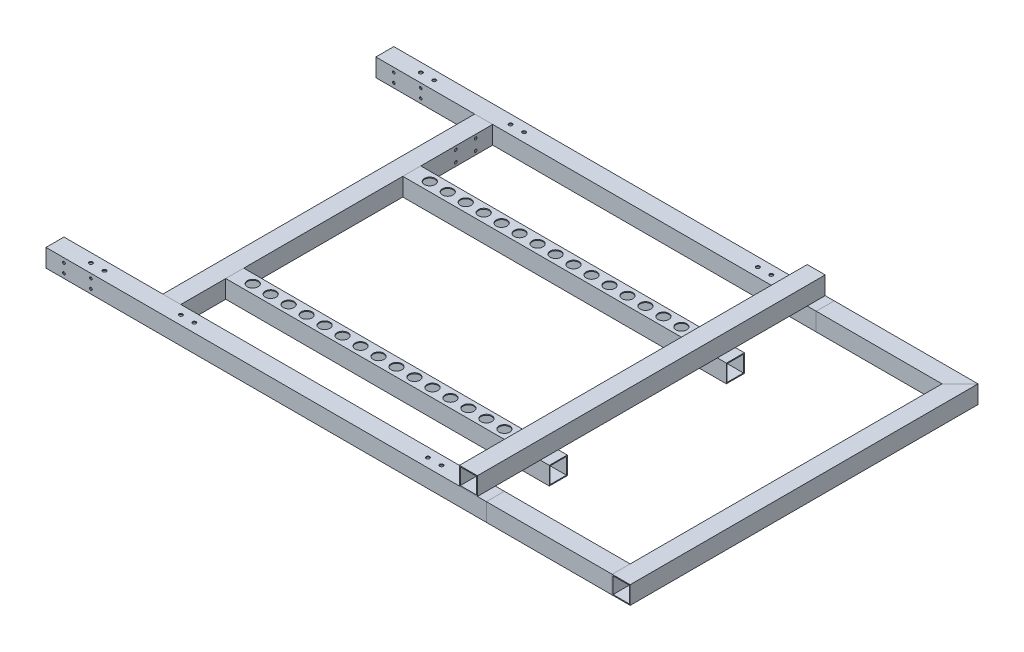
from build123d import *

# Parameters (mm, degrees)
SKETCH_11_W                 = 20
SKETCH_11_H                 = 20
SKETCH_11_W_2               = 18
SKETCH_11_H_2               = 18
F_20X20X1_1_DEPTH           = 500
SKETCH_11_ON_SEGMENT_2_W    = 20
SKETCH_11_ON_SEGMENT_2_H    = 20
SKETCH_11_ON_SEGMENT_2_W_2  = 18
SKETCH_11_ON_SEGMENT_2_H_2  = 18
F_20X20X1_1_2_DEPTH         = 515.142135624
SKETCH_11_ON_SEGMENT_3_W    = 20
SKETCH_11_ON_SEGMENT_3_H    = 20
SKETCH_11_ON_SEGMENT_3_W_2  = 18
SKETCH_11_ON_SEGMENT_3_H_2  = 18
F_20X20X1_1_3_DEPTH         = 110.284271247
SKETCH_11_ON_SEGMENT_4_W    = 20
SKETCH_11_ON_SEGMENT_4_H    = 20
SKETCH_11_ON_SEGMENT_4_W_2  = 18
SKETCH_11_ON_SEGMENT_4_H_2  = 18
F_20X20X1_1_4_DEPTH         = 515.142135624
SKETCH_11_ON_SEGMENT_5_W    = 20
SKETCH_11_ON_SEGMENT_5_H    = 20
SKETCH_11_ON_SEGMENT_5_W_2  = 18
SKETCH_11_ON_SEGMENT_5_H_2  = 18
F_20X20X1_1_5_DEPTH         = 369
SKETCH_11_ON_SEGMENT_6_W    = 20
SKETCH_11_ON_SEGMENT_6_H    = 20
SKETCH_11_ON_SEGMENT_6_W_2  = 18
SKETCH_11_ON_SEGMENT_6_H_2  = 18
F_20X20X1_1_6_DEPTH         = 82
SKETCH_12_R                 = 1.5
CUT_EXTRUDE_1_DEPTH         = 633.35195896
SKETCH_14_W                 = 20
SKETCH_14_H                 = 20
SKETCH_14_W_2               = 18
SKETCH_14_H_2               = 18
F_20X20X1_2_DEPTH           = 165.142135624
SKETCH_14_ON_SEGMENT_2_W    = 20
SKETCH_14_ON_SEGMENT_2_H    = 20
SKETCH_14_ON_SEGMENT_2_W_2  = 18
SKETCH_14_ON_SEGMENT_2_H_2  = 18
F_20X20X1_2_2_DEPTH         = 477.284271247
SKETCH_14_ON_SEGMENT_3_W    = 20
SKETCH_14_ON_SEGMENT_3_H    = 20
SKETCH_14_ON_SEGMENT_3_W_2  = 18
SKETCH_14_ON_SEGMENT_3_H_2  = 18
F_20X20X1_2_3_DEPTH         = 165.142135624
SKETCH_14_ON_SEGMENT_4_W    = 20
SKETCH_14_ON_SEGMENT_4_H    = 20
SKETCH_14_ON_SEGMENT_4_W_2  = 18
SKETCH_14_ON_SEGMENT_4_H_2  = 18
F_20X20X1_2_4_DEPTH         = 151
SKETCH_16_W                 = 20
SKETCH_16_H                 = 20
SKETCH_16_W_2               = 18
SKETCH_16_H_2               = 18
F_20X20X1_3_DEPTH           = 467
SKETCH_110_W                = 20
SKETCH_110_H                = 20
SKETCH_110_W_2              = 18
SKETCH_110_H_2              = 18
F_20X20X1_4_DEPTH           = 360
SKETCH_110_ON_SEGMENT_2_W   = 20
SKETCH_110_ON_SEGMENT_2_H   = 20
SKETCH_110_ON_SEGMENT_2_W_2 = 18
SKETCH_110_ON_SEGMENT_2_H_2 = 18
F_20X20X1_4_2_DEPTH         = 360
SKETCH_111_R                = 6
CUT_EXTRUDE_3_DEPTH         = 804.024906214
CUT_EXTRUDE_START           = -217
SKETCH_112_R                = 1.5
CUT_EXTRUDE_4_DEPTH         = 217
SKETCH_17_R                 = 1.5
CUT_EXTRUDE_5_DEPTH         = 693.927846172
CUT_EXTRUDE_7_DEPTH         = 80
SKETCH_114_R                = 2
CUT_EXTRUDE_8_DEPTH         = 762.136650018
SKETCH_115_R                = 2
CUT_EXTRUDE_9_DEPTH         = 762.136650018
SKETCH_116_W                = 20
SKETCH_116_H                = 20
CUT_EXTRUDE_10_DEPTH        = 766.682048895


with BuildPart() as part:
    # 草图11 → 铝管 20X20X1(1) (new body)
    with BuildSketch(Plane(origin=(0, 0, 0), x_dir=(0, 0, -1), z_dir=(1, 0, 0))):
        Rectangle(SKETCH_11_W, SKETCH_11_H)
        Rectangle(SKETCH_11_W_2, SKETCH_11_H_2, mode=Mode.SUBTRACT)
    extrude(amount=F_20X20X1_1_DEPTH)


with BuildPart() as body_2:
    # 草图11 on segment 2 (carried to segment 2) → 20X20X1_1 2 (new body)
    with BuildSketch(Plane(origin=(-15.142135624, 0, 447), x_dir=(0, 0, -1), z_dir=(1, 0, 0))):
        Rectangle(SKETCH_11_ON_SEGMENT_2_W, SKETCH_11_ON_SEGMENT_2_H)
        Rectangle(SKETCH_11_ON_SEGMENT_2_W_2, SKETCH_11_ON_SEGMENT_2_H_2, mode=Mode.SUBTRACT)
    extrude(amount=F_20X20X1_1_2_DEPTH)

    # 20X20X1_1 2 mitre 1
    split(bisect_by=Plane(origin=(0, 0, 447), x_dir=(0, 1, 0), z_dir=(0.707106781, 0, 0.707106781)), keep=Keep.TOP)


with BuildPart() as body_3:
    # 草图11 on segment 3 (carried to segment 3) → 20X20X1_1 3 (new body)
    with BuildSketch(Plane.XY.offset(351.857864376)):
        Rectangle(SKETCH_11_ON_SEGMENT_3_W, SKETCH_11_ON_SEGMENT_3_H)
        Rectangle(SKETCH_11_ON_SEGMENT_3_W_2, SKETCH_11_ON_SEGMENT_3_H_2, mode=Mode.SUBTRACT)
    extrude(amount=F_20X20X1_1_3_DEPTH)

    # 20X20X1_1 3 mitre 1
    split(bisect_by=Plane(origin=(0, 0, 367), x_dir=(0, -1, 0), z_dir=(-0.707106781, 0, 0.707106781)), keep=Keep.TOP)

    # 20X20X1_1 3 mitre 2
    split(bisect_by=Plane(origin=(0, 0, 447), x_dir=(0, -1, 0), z_dir=(-0.707106781, 0, -0.707106781)), keep=Keep.TOP)


with BuildPart() as body_4:
    # 草图11 on segment 4 (carried to segment 4) → 20X20X1_1 4 (new body)
    with BuildSketch(Plane(origin=(-15.142135624, 0, 367), x_dir=(0, 0, -1), z_dir=(1, 0, 0))):
        Rectangle(SKETCH_11_ON_SEGMENT_4_W, SKETCH_11_ON_SEGMENT_4_H)
        Rectangle(SKETCH_11_ON_SEGMENT_4_W_2, SKETCH_11_ON_SEGMENT_4_H_2, mode=Mode.SUBTRACT)
    extrude(amount=F_20X20X1_1_4_DEPTH)

    # 20X20X1_1 4 mitre 1
    split(bisect_by=Plane(origin=(0, 0, 367), x_dir=(0, 1, 0), z_dir=(0.707106781, 0, -0.707106781)), keep=Keep.TOP)


with BuildPart() as body_5:
    # 草图11 on segment 5 (carried to segment 5) → 20X20X1_1 5 (new body)
    with BuildSketch(Plane(origin=(130, 0, -1), x_dir=(1, 0, 0), z_dir=(0, 0, 1))):
        Rectangle(SKETCH_11_ON_SEGMENT_5_W, SKETCH_11_ON_SEGMENT_5_H)
        Rectangle(SKETCH_11_ON_SEGMENT_5_W_2, SKETCH_11_ON_SEGMENT_5_H_2, mode=Mode.SUBTRACT)
    extrude(amount=F_20X20X1_1_5_DEPTH)

    # 20X20X1_1 5 mitre 1
    split(bisect_by=Plane(origin=(130, 0, 367), x_dir=(0, 1, 0), z_dir=(0, 0, -1)), keep=Keep.TOP)

    # 20X20X1_1 5 mitre 2
    split(bisect_by=Plane(origin=(130, 0, 10), x_dir=(0, -1, 0), z_dir=(0, 0, 1)), keep=Keep.TOP)

    # 20X20X1_1 5 mitre 3
    split(bisect_by=Plane(origin=(130, 0, 357), x_dir=(0, 1, 0), z_dir=(0, 0, -1)), keep=Keep.TOP)

    # 草图17 → 切除-拉伸5 (cut, through all)
    with BuildSketch(Plane(origin=(140, 0, 0), x_dir=(0, 0, -1), z_dir=(1, 0, 0))):
        with Locations((-51, 6)):
            Circle(SKETCH_17_R)
        with Locations((-51, -6)):
            Circle(SKETCH_17_R)
        with Locations((-29, 6)):
            Circle(SKETCH_17_R)
        with Locations((-29, -6)):
            Circle(SKETCH_17_R)
    extrude(amount=-CUT_EXTRUDE_5_DEPTH, mode=Mode.SUBTRACT)


with BuildPart() as body_6:
    # 草图11 on segment 6 (carried to segment 6) → 20X20X1_1 6 (new body)
    with BuildSketch(Plane(origin=(130, 0, 366), x_dir=(1, 0, 0), z_dir=(0, 0, 1))):
        Rectangle(SKETCH_11_ON_SEGMENT_6_W, SKETCH_11_ON_SEGMENT_6_H)
        Rectangle(SKETCH_11_ON_SEGMENT_6_W_2, SKETCH_11_ON_SEGMENT_6_H_2, mode=Mode.SUBTRACT)
    extrude(amount=F_20X20X1_1_6_DEPTH)

    # 20X20X1_1 6 mitre 1
    split(bisect_by=Plane(origin=(130, 0, 367), x_dir=(0, -1, 0), z_dir=(0, 0, 1)), keep=Keep.TOP)

    # 20X20X1_1 6 mitre 2
    split(bisect_by=Plane(origin=(130, 0, 377), x_dir=(0, -1, 0), z_dir=(0, 0, 1)), keep=Keep.TOP)

    # 20X20X1_1 6 mitre 3
    split(bisect_by=Plane(origin=(130, 0, 437), x_dir=(0, 1, 0), z_dir=(0, 0, -1)), keep=Keep.TOP)


with BuildPart() as cut_extrude_1_tool:
    # 草图12 → 切除-拉伸1 (new, through all)
    with BuildSketch(Plane.XY.offset(377)):
        with Locations((30, 5)):
            Circle(SKETCH_12_R)
        with Locations((60, 5)):
            Circle(SKETCH_12_R)
        with Locations((30, -5)):
            Circle(SKETCH_12_R)
        with Locations((60, -5)):
            Circle(SKETCH_12_R)
    extrude(amount=-CUT_EXTRUDE_1_DEPTH)


with BuildPart() as part_1:
    add(part.part)

    # 切除-拉伸1: cut by cut_extrude_1_tool
    add(cut_extrude_1_tool.part, mode=Mode.SUBTRACT)

    # 草图115 → 切除-拉伸9 (cut, through all)
    with BuildSketch(Plane.XZ.offset(10)):
        with Locations(Location((50, 0, 0), (0, 0, 270))):
            Circle(SKETCH_115_R)
        with Locations(Location((65, 0, 0), (0, 0, 270))):
            Circle(SKETCH_115_R)
        with Locations(Location((150, 0, 0), (0, 0, 270))):
            Circle(SKETCH_115_R)
        with Locations(Location((165, 0, 0), (0, 0, 270))):
            Circle(SKETCH_115_R)
        with Locations(Location((440, 0, 0), (0, 0, 270))):
            Circle(SKETCH_115_R)
        with Locations(Location((425, 0, 0), (0, 0, 270))):
            Circle(SKETCH_115_R)
    extrude(amount=-CUT_EXTRUDE_9_DEPTH, mode=Mode.SUBTRACT)


with BuildPart() as body_4_1:
    add(body_4.part)

    # 切除-拉伸1: cut by cut_extrude_1_tool
    add(cut_extrude_1_tool.part, mode=Mode.SUBTRACT)

    # 草图114 → 切除-拉伸8 (cut, through all)
    with BuildSketch(Plane.XZ.offset(10)):
        with Locations(Location((49.999999674, 367.000008181, 0), (0, 0, 270))):
            Circle(SKETCH_114_R)
        with Locations(Location((64.999999674, 367.000008181, 0), (0, 0, 270))):
            Circle(SKETCH_114_R)
        with Locations(Location((149.999999674, 367.000008181, 0), (0, 0, 270))):
            Circle(SKETCH_114_R)
        with Locations(Location((164.999999674, 367.000008181, 0), (0, 0, 270))):
            Circle(SKETCH_114_R)
        with Locations(Location((424.999999674, 367.000008181, 0), (0, 0, 270))):
            Circle(SKETCH_114_R)
        with Locations(Location((439.999999674, 367.000008181, 0), (0, 0, 270))):
            Circle(SKETCH_114_R)
    extrude(amount=-CUT_EXTRUDE_8_DEPTH, mode=Mode.SUBTRACT)


with BuildPart() as body_7:
    # 草图14 → 铝管 20X20X1(2) (new body)
    with BuildSketch(Plane(origin=(500, 0, 447), x_dir=(0, 0, -1), z_dir=(1, 0, 0))):
        Rectangle(SKETCH_14_W, SKETCH_14_H)
        Rectangle(SKETCH_14_W_2, SKETCH_14_H_2, mode=Mode.SUBTRACT)
    extrude(amount=F_20X20X1_2_DEPTH)

    # 铝管 20X20X1(2) mitre 1
    split(bisect_by=Plane(origin=(650, 0, 447), x_dir=(0, -1, 0), z_dir=(-0.707106781, 0, 0.707106781)), keep=Keep.TOP)


with BuildPart() as body_8:
    # 草图14 on segment 2 (carried to segment 2) → 20X20X1_2 2 (new body)
    with BuildSketch(Plane(origin=(650, 0, 462.142135624), x_dir=(-1, 0, 0), z_dir=(0, 0, -1))):
        Rectangle(SKETCH_14_ON_SEGMENT_2_W, SKETCH_14_ON_SEGMENT_2_H)
        Rectangle(SKETCH_14_ON_SEGMENT_2_W_2, SKETCH_14_ON_SEGMENT_2_H_2, mode=Mode.SUBTRACT)
    extrude(amount=F_20X20X1_2_2_DEPTH)

    # 20X20X1_2 2 mitre 1
    split(bisect_by=Plane(origin=(650, 0, 447), x_dir=(0, 1, 0), z_dir=(0.707106781, 0, -0.707106781)), keep=Keep.TOP)

    # 20X20X1_2 2 mitre 2
    split(bisect_by=Plane(origin=(650, 0, 0), x_dir=(0, 1, 0), z_dir=(0.707106781, 0, 0.707106781)), keep=Keep.TOP)


with BuildPart() as body_9:
    # 草图14 on segment 3 (carried to segment 3) → 20X20X1_2 3 (new body)
    with BuildSketch(Plane.ZY.offset(-665.142135624)):
        Rectangle(SKETCH_14_ON_SEGMENT_3_W, SKETCH_14_ON_SEGMENT_3_H)
        Rectangle(SKETCH_14_ON_SEGMENT_3_W_2, SKETCH_14_ON_SEGMENT_3_H_2, mode=Mode.SUBTRACT)
    extrude(amount=F_20X20X1_2_3_DEPTH)

    # 20X20X1_2 3 mitre 1
    split(bisect_by=Plane(origin=(650, 0, 0), x_dir=(0, -1, 0), z_dir=(-0.707106781, 0, -0.707106781)), keep=Keep.TOP)


with BuildPart() as body_10:
    # 草图14 on segment 4 (carried to segment 4) → 20X20X1_2 4 (new body)
    with BuildSketch(Plane(origin=(500, 0, 367), x_dir=(0, 0, -1), z_dir=(1, 0, 0))):
        Rectangle(SKETCH_14_ON_SEGMENT_4_W, SKETCH_14_ON_SEGMENT_4_H)
        Rectangle(SKETCH_14_ON_SEGMENT_4_W_2, SKETCH_14_ON_SEGMENT_4_H_2, mode=Mode.SUBTRACT)
    extrude(amount=F_20X20X1_2_4_DEPTH)

    # 20X20X1_2 4 mitre 1
    split(bisect_by=Plane(origin=(640, 0, 367), x_dir=(0, -1, 0), z_dir=(-1, 0, 0)), keep=Keep.TOP)


with BuildPart() as body_11:
    # 草图16 → 铝管 20X20X1(3) (new body)
    with BuildSketch(Plane(origin=(480, 20, -10), x_dir=(1, 0, 0), z_dir=(0, 0, 1))):
        Rectangle(SKETCH_16_W, SKETCH_16_H)
        Rectangle(SKETCH_16_W_2, SKETCH_16_H_2, mode=Mode.SUBTRACT)
    extrude(amount=F_20X20X1_3_DEPTH)


with BuildPart() as body_12:
    # 草图110 → 铝管 20X20X1(4) (new body)
    with BuildSketch(Plane(origin=(140, 0, 100), x_dir=(0, 0, -1), z_dir=(1, 0, 0))):
        Rectangle(SKETCH_110_W, SKETCH_110_H)
        Rectangle(SKETCH_110_W_2, SKETCH_110_H_2, mode=Mode.SUBTRACT)
    extrude(amount=F_20X20X1_4_DEPTH)


with BuildPart() as body_13:
    # 草图110 on segment 2 (carried to segment 2) → 20X20X1_4 2 (new body)
    with BuildSketch(Plane(origin=(140, 0, 297), x_dir=(0, 0, -1), z_dir=(1, 0, 0))):
        Rectangle(SKETCH_110_ON_SEGMENT_2_W, SKETCH_110_ON_SEGMENT_2_H)
        Rectangle(SKETCH_110_ON_SEGMENT_2_W_2, SKETCH_110_ON_SEGMENT_2_H_2, mode=Mode.SUBTRACT)
    extrude(amount=F_20X20X1_4_2_DEPTH)


with BuildPart() as cut_extrude_3_tool:
    # 草图111 → 切除-拉伸3 (new, through all)
    with BuildSketch(Plane(origin=(0, 10, 0), x_dir=(1, 0, 0), z_dir=(0, 1, 0))):
        with Locations(Location((160, -100, 0), (0, 0, 270))):
            Circle(SKETCH_111_R)
        with Locations(Location((160, -297, 0), (0, 0, 270))):
            Circle(SKETCH_111_R)
        with Locations(Location((180, -100, 0), (0, 0, 270))):
            Circle(SKETCH_111_R)
        with Locations(Location((180, -297, 0), (0, 0, 270))):
            Circle(SKETCH_111_R)
        with Locations(Location((200, -100, 0), (0, 0, 270))):
            Circle(SKETCH_111_R)
        with Locations(Location((200, -297, 0), (0, 0, 270))):
            Circle(SKETCH_111_R)
        with Locations(Location((220, -100, 0), (0, 0, 270))):
            Circle(SKETCH_111_R)
        with Locations(Location((220, -297, 0), (0, 0, 270))):
            Circle(SKETCH_111_R)
        with Locations(Location((240, -100, 0), (0, 0, 270))):
            Circle(SKETCH_111_R)
        with Locations(Location((240, -297, 0), (0, 0, 270))):
            Circle(SKETCH_111_R)
        with Locations(Location((260, -100, 0), (0, 0, 270))):
            Circle(SKETCH_111_R)
        with Locations(Location((260, -297, 0), (0, 0, 270))):
            Circle(SKETCH_111_R)
        with Locations(Location((280, -100, 0), (0, 0, 270))):
            Circle(SKETCH_111_R)
        with Locations(Location((280, -297, 0), (0, 0, 270))):
            Circle(SKETCH_111_R)
        with Locations(Location((300, -100, 0), (0, 0, 270))):
            Circle(SKETCH_111_R)
        with Locations(Location((300, -297, 0), (0, 0, 270))):
            Circle(SKETCH_111_R)
        with Locations(Location((320, -100, 0), (0, 0, 270))):
            Circle(SKETCH_111_R)
        with Locations(Location((320, -297, 0), (0, 0, 270))):
            Circle(SKETCH_111_R)
        with Locations(Location((340, -100, 0), (0, 0, 270))):
            Circle(SKETCH_111_R)
        with Locations(Location((340, -297, 0), (0, 0, 270))):
            Circle(SKETCH_111_R)
        with Locations(Location((360, -100, 0), (0, 0, 270))):
            Circle(SKETCH_111_R)
        with Locations(Location((360, -297, 0), (0, 0, 270))):
            Circle(SKETCH_111_R)
        with Locations(Location((380, -100, 0), (0, 0, 270))):
            Circle(SKETCH_111_R)
        with Locations(Location((380, -297, 0), (0, 0, 270))):
            Circle(SKETCH_111_R)
        with Locations(Location((400, -100, 0), (0, 0, 270))):
            Circle(SKETCH_111_R)
        with Locations(Location((400, -297, 0), (0, 0, 270))):
            Circle(SKETCH_111_R)
        with Locations(Location((420, -100, 0), (0, 0, 270))):
            Circle(SKETCH_111_R)
        with Locations(Location((420, -297, 0), (0, 0, 270))):
            Circle(SKETCH_111_R)
        with Locations(Location((440, -100, 0), (0, 0, 270))):
            Circle(SKETCH_111_R)
        with Locations(Location((440, -297, 0), (0, 0, 270))):
            Circle(SKETCH_111_R)
    extrude(amount=-CUT_EXTRUDE_3_DEPTH)


with BuildPart() as body_12_1:
    add(body_12.part)

    # 切除-拉伸3: cut by cut_extrude_3_tool
    add(cut_extrude_3_tool.part, mode=Mode.SUBTRACT)


with BuildPart() as body_13_1:
    add(body_13.part)

    # 切除-拉伸3: cut by cut_extrude_3_tool
    add(cut_extrude_3_tool.part, mode=Mode.SUBTRACT)


with BuildPart() as cut_extrude_4_tool:
    # 草图112 → 切除-拉伸4 (new body)
    with BuildSketch(Plane.XY.offset(307).offset(CUT_EXTRUDE_START)):
        with Locations((462, 0)):
            Circle(SKETCH_112_R)
    extrude(amount=CUT_EXTRUDE_4_DEPTH)


with BuildPart() as body_12_2:
    add(body_12_1.part)

    # 切除-拉伸4: cut by cut_extrude_4_tool
    add(cut_extrude_4_tool.part, mode=Mode.SUBTRACT)


with BuildPart() as body_13_2:
    add(body_13_1.part)

    # 切除-拉伸4: cut by cut_extrude_4_tool
    add(cut_extrude_4_tool.part, mode=Mode.SUBTRACT)


with BuildPart() as cut_extrude_7_tool:
    # 草图113 → 切除-拉伸7 (new body)
    with BuildSketch(Plane.XY.offset(457)):
        Polygon((500, -10), (660, -10), (660, 10), (518.890990639, 10), (500, 10), align=None)
        Polygon((-10, -10), (500, -10), (500, 10), (418.532570431, 10), (-10, 10), align=None)
        Polygon((500, 10), (518.890990639, 10), (518.890990639, 44.57455739), (418.532570431, 44.57455739), (418.532570431, 10), align=None)
    extrude(amount=-CUT_EXTRUDE_7_DEPTH)


with BuildPart() as body_2_1:
    add(body_2.part)

    # 切除-拉伸7: cut by cut_extrude_7_tool
    add(cut_extrude_7_tool.part, mode=Mode.SUBTRACT)


with BuildPart() as body_3_1:
    add(body_3.part)

    # 切除-拉伸7: cut by cut_extrude_7_tool
    add(cut_extrude_7_tool.part, mode=Mode.SUBTRACT)


with BuildPart() as body_6_1:
    add(body_6.part)

    # 切除-拉伸7: cut by cut_extrude_7_tool
    add(cut_extrude_7_tool.part, mode=Mode.SUBTRACT)


with BuildPart() as body_7_1:
    add(body_7.part)

    # 切除-拉伸7: cut by cut_extrude_7_tool
    add(cut_extrude_7_tool.part, mode=Mode.SUBTRACT)


with BuildPart() as body_8_1:
    add(body_8.part)

    # 切除-拉伸7: cut by cut_extrude_7_tool
    add(cut_extrude_7_tool.part, mode=Mode.SUBTRACT)


with BuildPart() as body_11_1:
    add(body_11.part)

    # 切除-拉伸7: cut by cut_extrude_7_tool
    add(cut_extrude_7_tool.part, mode=Mode.SUBTRACT)


with BuildPart() as cut_extrude_10_tool:
    # 草图116 → 切除-拉伸10 (new, through all)
    with BuildSketch(Plane.XY.offset(377)):
        Rectangle(SKETCH_116_W, SKETCH_116_H)
    extrude(amount=-CUT_EXTRUDE_10_DEPTH)


with BuildPart() as part_2:
    add(part_1.part)

    # 切除-拉伸10: cut by cut_extrude_10_tool
    add(cut_extrude_10_tool.part, mode=Mode.SUBTRACT)


with BuildPart() as body_3_2:
    add(body_3_1.part)

    # 切除-拉伸10: cut by cut_extrude_10_tool
    add(cut_extrude_10_tool.part, mode=Mode.SUBTRACT)


with BuildPart() as body_4_2:
    add(body_4_1.part)

    # 切除-拉伸10: cut by cut_extrude_10_tool
    add(cut_extrude_10_tool.part, mode=Mode.SUBTRACT)


solid = Compound([body_5.part, body_9.part, body_10.part, body_12_2.part, body_13_2.part, body_8_1.part, body_11_1.part, part_2.part, body_4_2.part])
